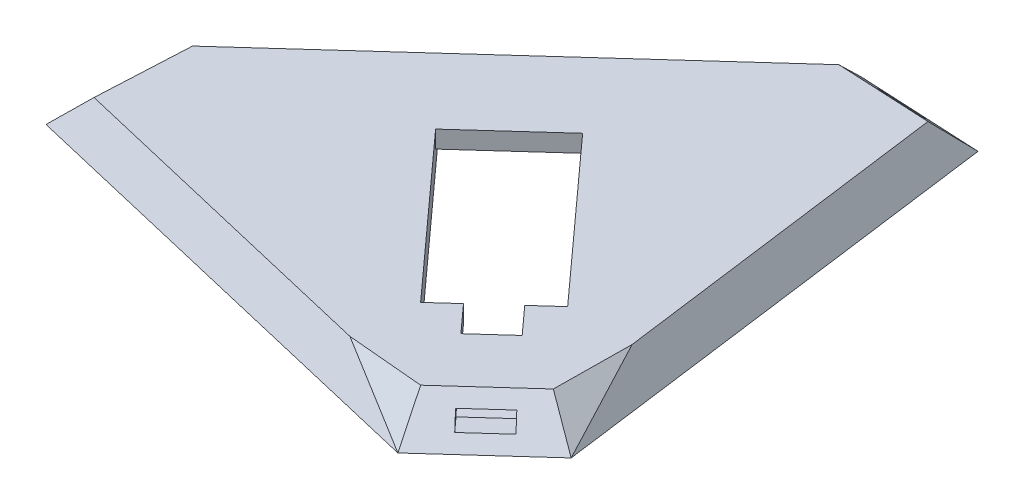
from build123d import *

# Parameters (mm, degrees)
BOSS_EXTRUDE1_DEPTH = 4
DRAFT1_ANGLE        = -45
DRAFT2_ANGLE        = -30.5
CUT_EXTRUDE5_DEPTH  = 2
CUT_EXTRUDE6_DEPTH  = 212.923325802
CUT_EXTRUDE9_DEPTH  = 2.2
CUT_EXTRUDE7_DEPTH  = 8.686291501
CUT_EXTRUDE8_DEPTH  = 8.686291501
CUT_EXTRUDE10_DEPTH = 2.2


with BuildPart() as part:
    # Sketch1 → Boss-Extrude1 (new body)
    with BuildSketch(Plane(origin=(0, 0, 0), x_dir=(1, 0, 0), z_dir=(0, 1, 0))):
        Polygon((52.494351143, -151.133854852), (51.789004581, -165.258389755), (104.862009772, -177.770248363), (115.348319519, -168.281449289), (108.186209242, -114.225971655), (94.061674339, -113.520625094), align=None)
    extrude(amount=BOSS_EXTRUDE1_DEPTH)

    # Draft1
    draft1_faces = [part.faces().sort_by_distance(p)[0] for p in [
        (73.278012741, 2, 132.327239973),
        (110.105164645, 2, 173.025848826),
        (52.141677862, 2, 158.196122303),
        (101.12394179, 2, 113.873298375),
    ]]
    draft(draft1_faces, Plane(origin=(0, 0, 0), x_dir=(0, 0, -1), z_dir=(0, -1, 0)), DRAFT1_ANGLE)

    # Draft2
    draft2_faces = [part.faces().sort_by_distance(p)[0] for p in [
        (78.138469796, 1.940570555, 171.470225357),
        (111.74202401, 1.940570555, 141.063210709),
    ]]
    draft(draft2_faces, Plane(origin=(0, 0, 0), x_dir=(0, 0, -1), z_dir=(0, -1, 0)), DRAFT2_ANGLE)

    # Sketch2 → Cut-Extrude5 (cut)
    with BuildSketch(Plane.XZ):
        Polygon((75.849733352, 144.111731538), (97.991394115, 168.581035955), (106.889322994, 160.52952295), (84.747662231, 136.060218533), align=None)
    extrude(amount=-CUT_EXTRUDE5_DEPTH, mode=Mode.SUBTRACT)

    # Sketch3 → Cut-Extrude6 (cut, through all)
    with BuildSketch(Plane.XZ.offset(-2)):
        Polygon((95.139816593, 165.429686144), (97.735045849, 163.081328184), (100.586623371, 166.232677995), (104.294093738, 162.87788091), (101.442516215, 159.726531099), (104.037745471, 157.378173139), (87.599239753, 139.211568345), (78.701310874, 147.263081349), align=None)
    extrude(amount=-CUT_EXTRUDE6_DEPTH, mode=Mode.SUBTRACT)

    # Sketch7 → Cut-Extrude9 (cut, along a direction that is not the sketch's normal)
    with BuildSketch(Plane(origin=(67.825186868, 101.086869254, 74.955314434), x_dir=(-0.5807891989379262, -0.19614622185114675, 0.7900699754139267), z_dir=(0.4744399537114777, 0.7071067811865489, 0.5243154873949929))):
        Polygon((74.094551817, 123.420131254), (69.290768622, 124.80709449), (69.845553917, 126.728607768), (74.649337111, 125.341644532), align=None)
    extrude(amount=-CUT_EXTRUDE9_DEPTH, dir=(0.6709594170704366, 0, 0.7414940732362599), mode=Mode.SUBTRACT)

    # Sketch4 → Cut-Extrude7 (cut, along a direction that is not the sketch's normal)
    with BuildSketch(Plane(origin=(0, 4, 0), x_dir=(1, 0, 0), z_dir=(0, 1, 0))):
        Polygon((112.587766826, -165.384890501), (111.435934245, -166.427154957), (111.53570927, -157.444566839), align=None)
    extrude(amount=-CUT_EXTRUDE7_DEPTH, dir=(-0.6637345426247422, 0.6785983445458476, -0.3145802659200979), mode=Mode.SUBTRACT)

    # Sketch6 → Cut-Extrude8 (cut, along a direction that is not the sketch's normal)
    with BuildSketch(Plane(origin=(0, 4, 0), x_dir=(1, 0, 0), z_dir=(0, 1, 0))):
        Polygon((102.254887128, -174.734854565), (103.406719709, -173.692590108), (94.458880925, -172.896961139), align=None)
    extrude(amount=-CUT_EXTRUDE8_DEPTH, dir=(-0.24688935673809265, 0.6785983445458336, -0.6917730352573054), mode=Mode.SUBTRACT)

    # Sketch8 → Cut-Extrude10 (cut, along a direction that is not the sketch's normal)
    with BuildSketch(Plane(origin=(29.94613408, -29.98345025, 1.495440583), x_dir=(0.7079857233236485, 0.7053499867326429, -0.03517970702195721), z_dir=(-0.7062267451533468, 0.7071067811865487, -0.03526732808291803))):
        Polygon((34.993140865, -160.762185663), (35.345376313, -155.774608076), (33.350345278, -155.633713897), (32.99810983, -160.621291484), align=None)
    cut_extrude10 = extrude(amount=-CUT_EXTRUDE10_DEPTH, dir=(-0.9987554411064721, 0, -0.04987553368352402), mode=Mode.SUBTRACT)

    # Mirror1: Cut-Extrude10 across plane
    add(cut_extrude10.mirror(Plane(origin=(-25.545209091, 0, 23.115219958), x_dir=(0.6709594170704504, 0, 0.7414940732362473), z_dir=(-0.7414940732362473, 0, 0.6709594170704505))), mode=Mode.SUBTRACT)


solid = part.part
